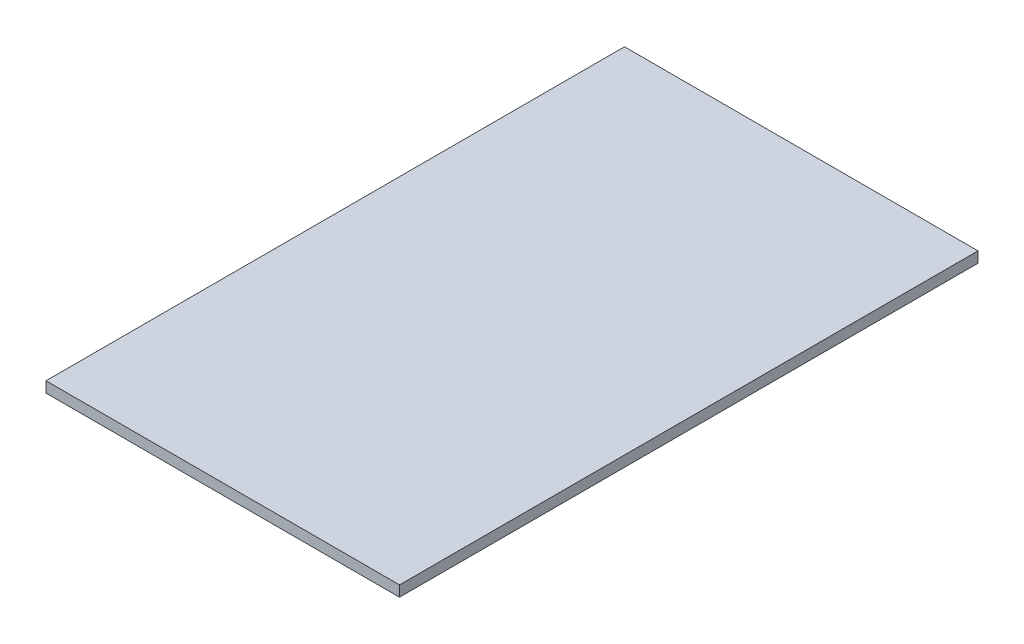
from build123d import *

# Parameters (mm, degrees)
SKETCH1_W           = 165
SKETCH1_H           = 270
BOSS_EXTRUDE1_DEPTH = 5


with BuildPart() as part:
    # Sketch1 → Boss-Extrude1 (new body)
    with BuildSketch(Plane(origin=(0, 0, 0), x_dir=(1, 0, 0), z_dir=(0, 1, 0))):
        Rectangle(SKETCH1_W, SKETCH1_H)
    extrude(amount=BOSS_EXTRUDE1_DEPTH)


solid = part.part
